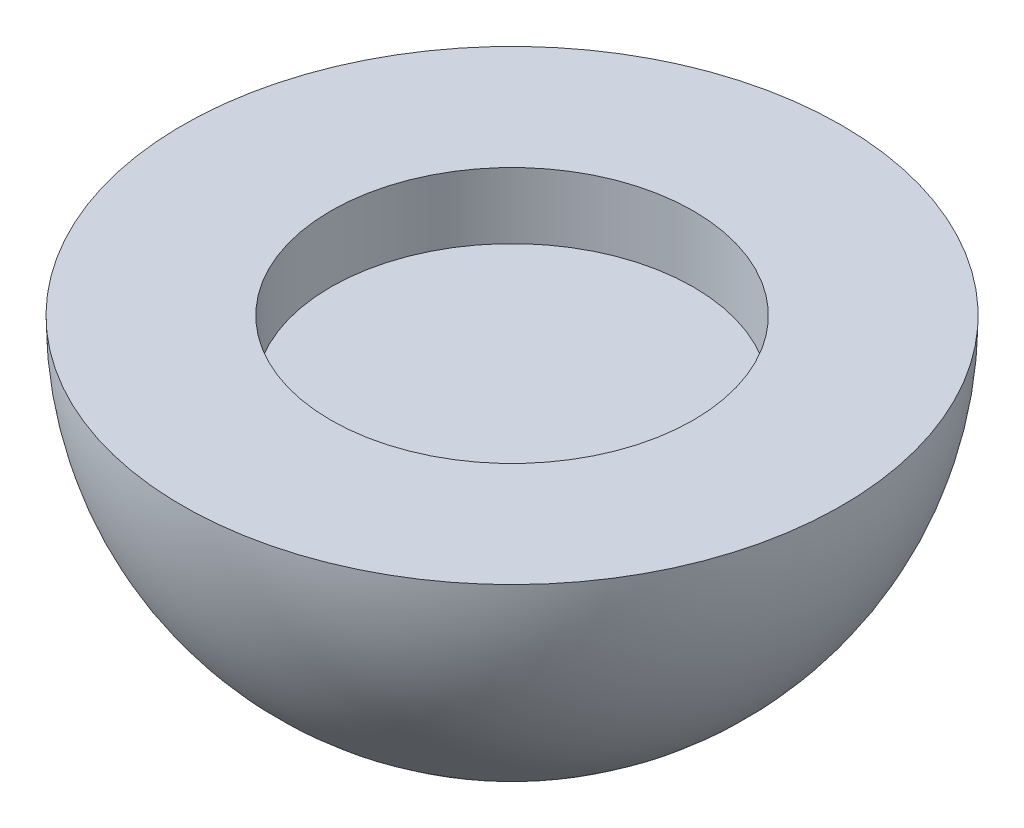
from build123d import *

# Parameters (mm, degrees)
REVOLVE1_ANGLE     = 180
SKETCH3_R          = 2.75
CUT_EXTRUDE1_DEPTH = 1


with BuildPart() as part:
    # Sketch1 → Revolve1 (revolve)
    with BuildSketch(Plane(origin=(0, 0, 0), x_dir=(1, 0, 0), z_dir=(0, 1, 0))):
        with BuildLine():
            Line((5, 0), (-5, 0))
            ThreePointArc((-5, 0), (0, 5), (5, 0))
        make_face()
    revolve(axis=Axis((5, 0, 0), (-1, 0, 0)), revolution_arc=REVOLVE1_ANGLE)

    # Sketch3 → Cut-Extrude1 (cut)
    with BuildSketch(Plane(origin=(0, 0, 0), x_dir=(1, 0, 0), z_dir=(0, 1, 0))):
        with Locations(Location((0, 0, 0), (0, 0, 270))):
            Circle(SKETCH3_R)
    extrude(amount=-CUT_EXTRUDE1_DEPTH, mode=Mode.SUBTRACT)


solid = part.part
